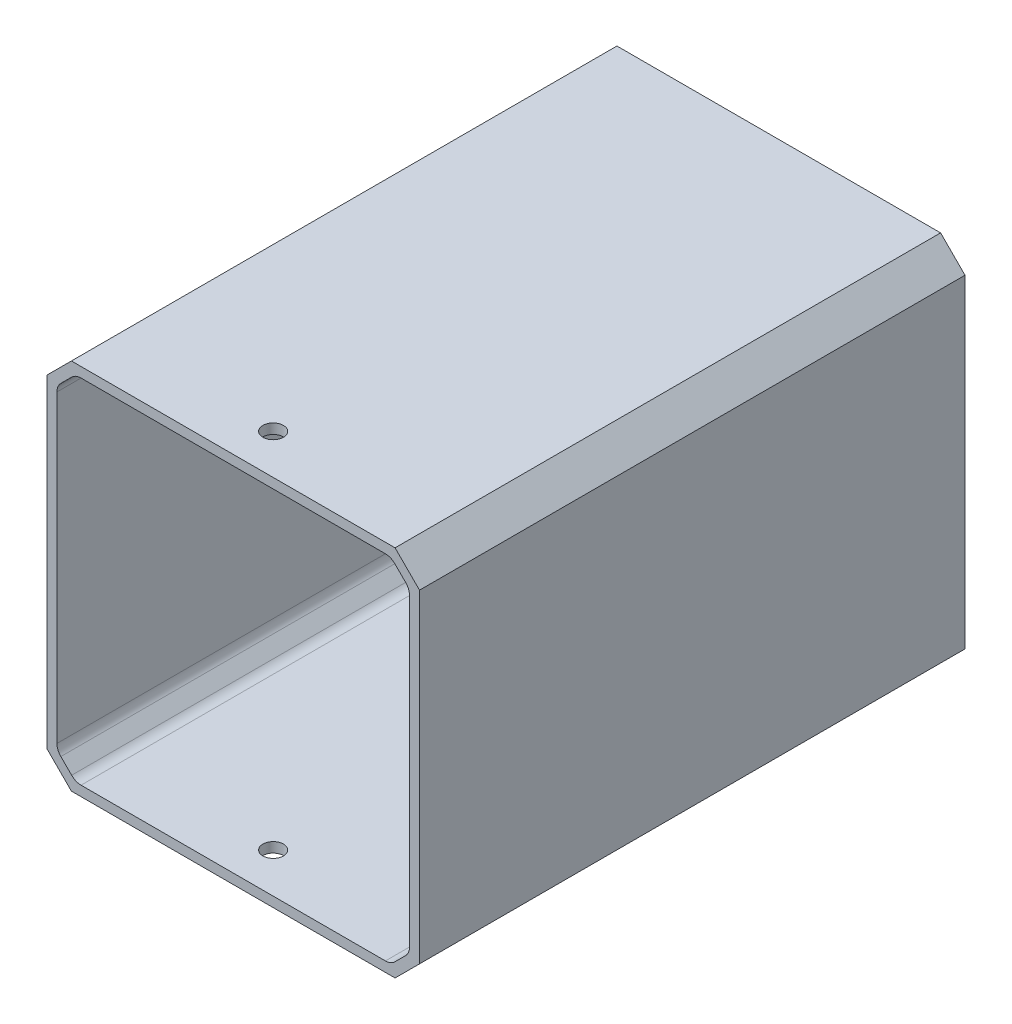
from build123d import *

# Parameters (mm, degrees)
ESQUISSE1_R                  = 11.15
BOSS_EXTRU_1_DEPTH           = 2
BOSS_EXTRU_2_DEPTH           = 80
BOSS_EXTRU_3_DEPTH           = 2.3
ENL_V_MAT_EXTRU_1_DEPTH      = 106.452595985
ENL_V_MAT_EXTRU_1_DEPTH_BACK = 106.452595985
ESQUISSE4_R                  = 1.55
BOSS_EXTRU_4_DEPTH           = 2
ENL_V_MAT_EXTRU_2_DEPTH      = 10
CONG_1_R                     = 2


with BuildPart() as part:
    # Esquisse1 → Boss.-Extru.1 (new body)
    with BuildSketch(Plane.XY):
        Polygon((-24.325901808, 28), (24.325901808, 28), (28, 24.325901808), (28, -24.325901808), (24.325901808, -28), (-24.325901808, -28), (-28, -24.325901808), (-28, 24.325901808), align=None)
        Circle(ESQUISSE1_R, mode=Mode.SUBTRACT)
    extrude(amount=BOSS_EXTRU_1_DEPTH)

    # Esquisse2 → Boss.-Extru.2 (add)
    with BuildSketch(Plane.XY.offset(2)):
        Polygon((-28, 24.325901808), (-28, -24.325901808), (-24.325901808, -28), (24.325901808, -28), (28, -24.325901808), (28, 24.325901808), (24.325901808, 28), (-24.325901808, 28), align=None)
        Polygon((-26.5, 23.704581464), (-26.5, -23.704581464), (-23.704581464, -26.5), (23.704581464, -26.5), (26.5, -23.704581464), (26.5, 23.704581464), (23.704581464, 26.5), (-23.704581464, 26.5), align=None, mode=Mode.SUBTRACT)
    extrude(amount=BOSS_EXTRU_2_DEPTH)

    # Esquisse3 → Boss.-Extru.3 (add)
    with BuildSketch(Plane(origin=(0, 0, 0), x_dir=(-1, 0, 0), z_dir=(0, 0, -1))):
        Polygon((-28, -20), (-28, 20), (-35.5, 12.5), (-35.5, -12.5), align=None)
        Polygon((-31.75, 3.175426481), (-34.5, 1.58771324), (-34.5, -1.58771324), (-31.75, -3.175426481), (-29, -1.58771324), (-29, 1.58771324), align=None, mode=Mode.SUBTRACT)
    extrude(amount=-BOSS_EXTRU_3_DEPTH)

    # Esquisse4 → Enlèv. mat.-Extru.1 (cut, two sides: drawn at the far end of the back side and taken through both)
    with BuildSketch(Plane(origin=(0, 28, 0), x_dir=(1, 0, 0), z_dir=(0, 1, 0)).offset(-ENL_V_MAT_EXTRU_1_DEPTH_BACK)):
        with Locations((0, -76)):
            Circle(ESQUISSE4_R)
    extrude(amount=ENL_V_MAT_EXTRU_1_DEPTH + ENL_V_MAT_EXTRU_1_DEPTH_BACK, mode=Mode.SUBTRACT)

    # Esquisse5 → Boss.-Extru.4 (add)
    with BuildSketch(Plane.XY.offset(2)):
        Polygon((-10.828088474, -1.05), (-12.1, -1.05), (-12.1, 1.05), (-10.828088474, 1.05), (-9.6, 1.05), (-9.6, -1.05), align=None)
    extrude(amount=-BOSS_EXTRU_4_DEPTH)

    # Esquisse6 → Enlèv. mat.-Extru.2 (cut)
    with BuildSketch(Plane.XY.offset(2.3)):
        Polygon((28, -20), (35.5, -12.5), (35.5, 12.5), (28, 20), align=None)
    extrude(amount=-ENL_V_MAT_EXTRU_2_DEPTH, mode=Mode.SUBTRACT)

    # Congé1
    cong_1_edges = [part.edges().sort_by_distance(p)[0] for p in [
        (-23.704581464, -26.5, 42),
        (23.704581464, -26.5, 42),
        (26.5, -23.704581464, 42),
        (26.5, 23.704581464, 42),
        (23.704581464, 26.5, 42),
        (-23.704581464, 26.5, 42),
        (-26.5, 23.704581464, 42),
        (-26.5, -23.704581464, 42),
    ]]
    fillet(cong_1_edges, radius=CONG_1_R)


solid = part.part
